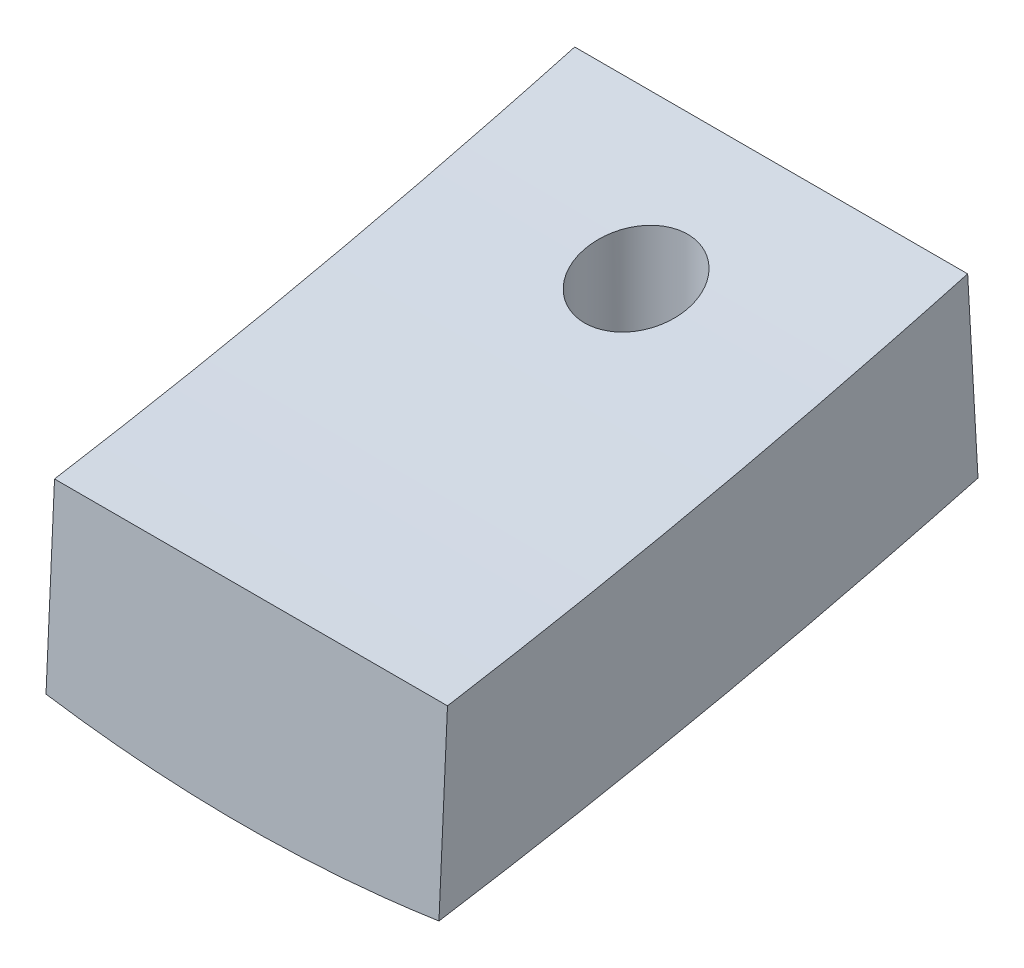
from build123d import *

# Parameters (mm, degrees)
SKETCH8_R          = 2.1
CUT_EXTRUDE2_DEPTH = 20.175814847


with BuildPart() as part:
    # Sweep1: sweep along a path in Sketch5
    with BuildLine() as sweep1_path:  # in the path sketch's own coordinates; laid on its plane below (add() does not lay a ready-made edge on the line's plane)
        add(Edge.make_bspline(
            [(12, -273.587448275), (1.118694171, -276.48109121), (-10, -278.234045614)],
            knots=[0, 0, 0, 1, 1, 1], degree=2))
    # Sketch2 → Sweep1 (sweep)
    with BuildSketch(Plane.XY):
        with BuildLine():
            Line((7.999671005, -275.908898325), (7.999671005, -268.48657561))
            Line((7.999671005, -268.48657561), (-8.000328995, -268.48657561))
            Line((-8.000328995, -268.48657561), (-8.000328995, -275.908898325))
            add(Edge.make_bspline(
                [(7.999671005, -275.908898325), (-0.000325582, -277.064252884), (-8.000328995, -275.908898325)],
                knots=[0, 0, 0, 1, 1, 1], degree=2))
        make_face()
    sweep(path=Plane(origin=(0, 0, 0), x_dir=(0, 0, -1), z_dir=(1, 0, 0)) * sweep1_path.line)

    # Sketch8 → Cut-Extrude2 (cut, through all)
    with BuildSketch(Plane(origin=(0, -265.669886224, 0), x_dir=(1, 0, 0), z_dir=(0, 1, 0))):
        with Locations(Location((-4.6e-08, 6.050192376, 0), (0, 0, 270))):
            Circle(SKETCH8_R)
    extrude(amount=-CUT_EXTRUDE2_DEPTH, mode=Mode.SUBTRACT)


solid = part.part
